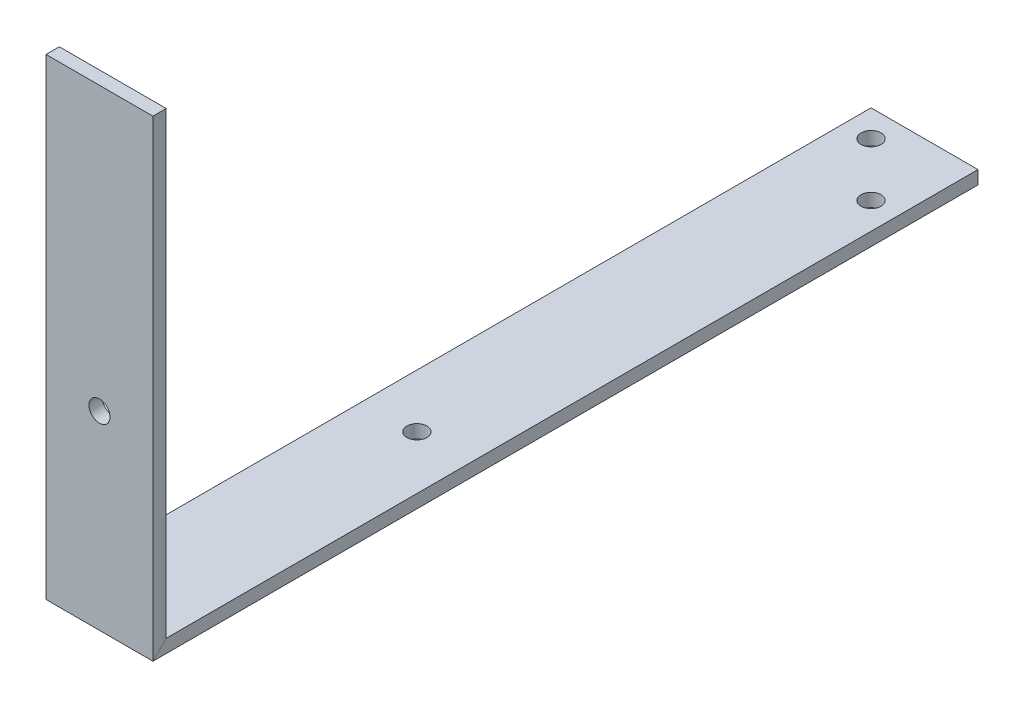
from build123d import *

# Parameters (mm, degrees)
CROQUIS2_W              = 50.8
CROQUIS2_H              = 6.31
CROQUIS3_W              = 50.8
CROQUIS3_H              = 6.31
CROQUIS4_W              = 60
CROQUIS4_H              = 53.155
SALIENTE_EXTRUIR1_DEPTH = 6.31
CROQUIS5_W              = 60
CROQUIS5_H              = 6.31
CORTAR_EXTRUIR1_DEPTH   = 6.31
CORTAR_EXTRUIR2_DEPTH   = 634
CROQUIS8_W              = 50.8
CROQUIS8_H              = 6.31
SALIENTE_EXTRUIR2_DEPTH = 63.5
CROQUIS9_R              = 5
CORTAR_EXTRUIR3_DEPTH   = 10
CROQUIS10_W             = 790.847933
CROQUIS10_H             = 6.31
CORTAR_EXTRUIR4_DEPTH   = 286
CROQUIS11_W             = 50.8
CROQUIS11_H             = 6.31
CROQUIS11_W_2           = 210
CORTAR_EXTRUIR5_DEPTH   = 13.11
CROQUIS12_W             = 50.8
CROQUIS12_H             = 6.31
SALIENTE_EXTRUIR3_DEPTH = 6.35
CROQUIS13_W             = 50.8
CROQUIS13_H             = 6.35
CORTAR_EXTRUIR6_DEPTH   = 6.35
CROQUIS14_W             = 85.847108528
CROQUIS14_H             = 473.639219469
CORTAR_EXTRUIR7_DEPTH   = 137
CROQUIS15_R             = 4.7625
CORTAR_EXTRUIR8_DEPTH   = 33
CROQUIS16_R             = 5
CORTAR_EXTRUIR9_DEPTH   = 33
CROQUIS18_R             = 4.7625
CORTAR_EXTRUIR10_DEPTH  = 50
CROQUIS19_W             = 50.8
CROQUIS19_H             = 6.31
SALIENTE_EXTRUIR4_DEPTH = 100


with BuildPart() as part:
    # Barrer1: sweep along a curve in space
    with BuildLine() as barrer1_path:
        Line((0, 0, 0), (0, -567.24, 0))
        Line((0, -567.24, 0), (0, -567.24, 336.2))
        Line((0, -567.24, 336.2), (1786.7, -567.24, 336.2))
        Line((1786.7, -567.24, 336.2), (1786.7, -567.24, 693.16))
        Line((1786.7, -567.24, 693.16), (1786.7, -436.23, 693.16))
        Line((1786.7, -436.23, 693.16), (1786.7, -436.23, 1487.162933))
    # Croquis2 → Barrer1 (sweep)
    with BuildSketch(Plane(origin=(0, 0, 0), x_dir=(1, 0, 0), z_dir=(0, 1, 0))):
        Rectangle(CROQUIS2_W, CROQUIS2_H)
        with Locations((210, 0)):
            Rectangle(CROQUIS2_W, CROQUIS2_H)
    sweep(path=barrer1_path.line, transition=Transition.RIGHT)

    # Barrer4: sweep along a curve in space
    with BuildLine() as barrer4_path:
        Line((-0.201028049, -3.155, -3.155), (-0.201028049, -3.155, -207.155))
        Line((-0.201028049, -3.155, -207.155), (-0.201028049, -53.155, -207.155))
    # Croquis3 → Barrer4 (sweep)
    with BuildSketch(Plane(origin=(0, 0, -3.155), x_dir=(-1, 0, 0), z_dir=(0, 0, -1))):
        with Locations((-210, -3.155)):
            Rectangle(CROQUIS3_W, CROQUIS3_H)
        with Locations((0, -3.155)):
            Rectangle(CROQUIS3_W, CROQUIS3_H)
    sweep(path=barrer4_path.line, transition=Transition.RIGHT)

    # Croquis4 → Saliente-Extruir1 (add)
    with BuildSketch(Plane(origin=(0, 0, -210.31), x_dir=(-1, 0, 0), z_dir=(0, 0, -1))):
        with Locations((-154.6, -26.5775)):
            Rectangle(CROQUIS4_W, CROQUIS4_H)
    extrude(amount=-SALIENTE_EXTRUIR1_DEPTH)

    # Croquis5 → Cortar-Extruir1 (cut)
    with BuildSketch(Plane.XY.offset(-204)):
        with Locations((154.6, -3.155)):
            Rectangle(CROQUIS5_W, CROQUIS5_H)
    extrude(amount=-CORTAR_EXTRUIR1_DEPTH, mode=Mode.SUBTRACT)

    # Croquis7 → Cortar-Extruir2 (cut)
    with BuildSketch(Plane(origin=(0, 0, 0), x_dir=(1, 0, 0), z_dir=(0, 1, 0))):
        Polygon((1761.3, -361.6), (2022.1, -361.6), (2022.1, 278.600557529), (-188.115947115, 278.600557529), (-188.115947115, -361.6), align=None)
    extrude(amount=-CORTAR_EXTRUIR2_DEPTH, mode=Mode.SUBTRACT)

    # Croquis8 → Saliente-Extruir2 (add)
    with BuildSketch(Plane(origin=(0, 0, 361.6), x_dir=(-1, 0, 0), z_dir=(0, 0, -1))):
        with Locations((-1786.7, -567.24)):
            Rectangle(CROQUIS8_W, CROQUIS8_H)
    extrude(amount=SALIENTE_EXTRUIR2_DEPTH)

    # Croquis9 → Cortar-Extruir3 (cut)
    with BuildSketch(Plane(origin=(0, -433.075, 0), x_dir=(1, 0, 0), z_dir=(0, 1, 0))):
        with Locations(Location((1786.7, -1454.162933, 0), (0, 0, 270))):
            Circle(CROQUIS9_R)
        with Locations(Location((1786.7, -1234.162933, 0), (0, 0, 270))):
            Circle(CROQUIS9_R)
        with Locations(Location((1996.7, -1234.162933, 0), (0, 0, 270))):
            Circle(CROQUIS9_R)
        with Locations(Location((1996.7, -1454.162933, 0), (0, 0, 270))):
            Circle(CROQUIS9_R)
    extrude(amount=-CORTAR_EXTRUIR3_DEPTH, mode=Mode.SUBTRACT)

    # Croquis10 → Cortar-Extruir4 (cut)
    with BuildSketch(Plane(origin=(2022.1, 0, 0), x_dir=(0, 0, -1), z_dir=(1, 0, 0))):
        with Locations((-1091.7389665, -436.23)):
            Rectangle(CROQUIS10_W, CROQUIS10_H)
    extrude(amount=-CORTAR_EXTRUIR4_DEPTH, mode=Mode.SUBTRACT)

    # Croquis11 → Cortar-Extruir5 (cut)
    with BuildSketch(Plane(origin=(0, -433.075, 0), x_dir=(1, 0, 0), z_dir=(0, 1, 0))):
        with Locations((1996.7, -693.16)):
            Rectangle(CROQUIS11_W, CROQUIS11_H)
        with Locations((1866.3, -693.16)):
            Rectangle(CROQUIS11_W_2, CROQUIS11_H)
    extrude(amount=-CORTAR_EXTRUIR5_DEPTH, mode=Mode.SUBTRACT)

    # Croquis12 → Saliente-Extruir3 (add)
    with BuildSketch(Plane(origin=(0, 0, 361.6), x_dir=(-1, 0, 0), z_dir=(0, 0, -1))):
        with Locations((-1996.7, -567.24)):
            Rectangle(CROQUIS12_W, CROQUIS12_H)
    extrude(amount=SALIENTE_EXTRUIR3_DEPTH)

    # Croquis13 → Cortar-Extruir6 (cut)
    with BuildSketch(Plane(origin=(0, -564.085, 0), x_dir=(1, 0, 0), z_dir=(0, 1, 0))):
        with Locations((1786.7, -301.275)):
            Rectangle(CROQUIS13_W, CROQUIS13_H)
    extrude(amount=-CORTAR_EXTRUIR6_DEPTH, mode=Mode.SUBTRACT)

    # Croquis14 → Cortar-Extruir7 (cut)
    with BuildSketch(Plane(origin=(0, -446.185, 0), x_dir=(1, 0, 0), z_dir=(0, 1, 0))):
        with Locations((1999.254154868, -571.717300183)):
            Rectangle(CROQUIS14_W, CROQUIS14_H)
    extrude(amount=-CORTAR_EXTRUIR7_DEPTH, mode=Mode.SUBTRACT)

    # Croquis15 → Cortar-Extruir8 (cut)
    with BuildSketch(Plane(origin=(0, -564.085, 0), x_dir=(1, 0, 0), z_dir=(0, 1, 0))):
        with Locations(Location((1786.7, -545.545, 0), (0, 0, 270))):
            Circle(CROQUIS15_R)
    extrude(amount=-CORTAR_EXTRUIR8_DEPTH, mode=Mode.SUBTRACT)

    # Croquis16 → Cortar-Extruir9 (cut)
    with BuildSketch(Plane(origin=(0, 0, 690.005), x_dir=(-1, 0, 0), z_dir=(0, 0, -1))):
        with Locations((-1786.7, -480.185)):
            Circle(CROQUIS16_R)
    extrude(amount=-CORTAR_EXTRUIR9_DEPTH, mode=Mode.SUBTRACT)

    # Croquis18 → Cortar-Extruir10 (cut)
    with BuildSketch(Plane(origin=(0, -570.395, 0), x_dir=(-1, 0, 0), z_dir=(0, -1, 0))):
        with Locations(Location((-1799.399999999, -342.552204666, 0), (0, 0, 90))):
            Circle(CROQUIS18_R)
        with Locations(Location((-1773.999999999, -317.152204666, 0), (0, 0, 90))):
            Circle(CROQUIS18_R)
    extrude(amount=-CORTAR_EXTRUIR10_DEPTH, mode=Mode.SUBTRACT)

    # Croquis19 → Saliente-Extruir4 (add)
    with BuildSketch(Plane(origin=(0, -446.185, 0), x_dir=(1, 0, 0), z_dir=(0, 1, 0))):
        with Locations((1786.7, -693.16)):
            Rectangle(CROQUIS19_W, CROQUIS19_H)
    extrude(amount=SALIENTE_EXTRUIR4_DEPTH)


solid = part.part
